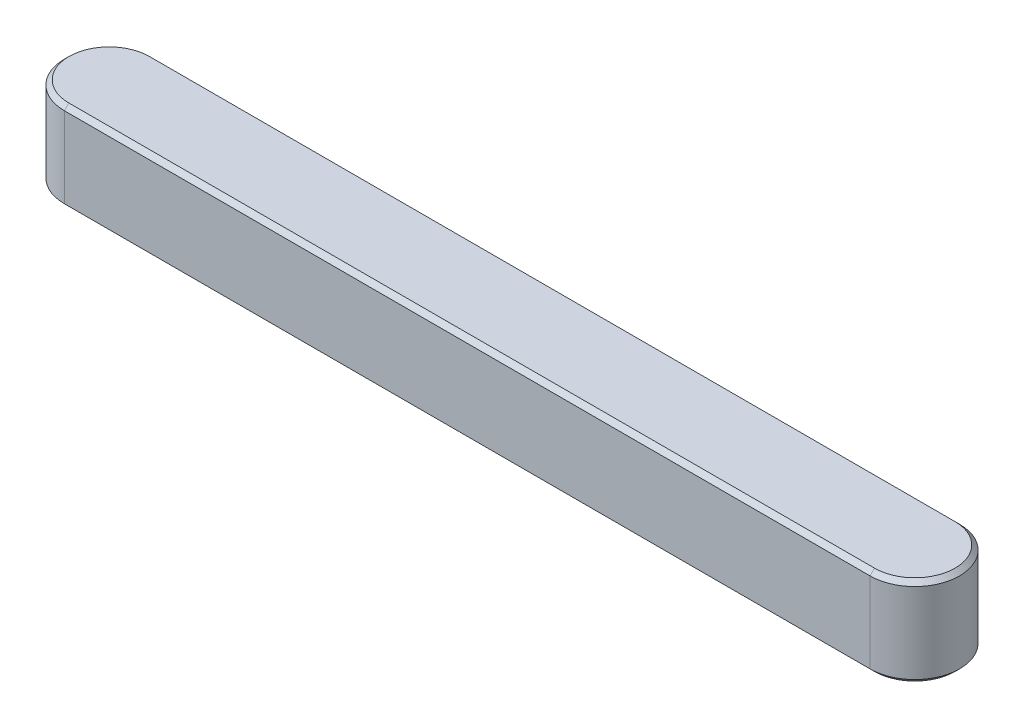
from build123d import *

# Parameters (mm, degrees)
SKETCH1_W           = 60
SKETCH1_H           = 6
BOSS_EXTRUDE1_DEPTH = 6
FILLET1_RADIUS      = 3
FILLET1_LENGTH      = 6
FILLET2_RADIUS      = 3
FILLET2_LENGTH      = 6
CHAMFER2_SIZE       = 0.3


with BuildPart() as part:
    # Sketch1 → Boss-Extrude1 (new body)
    with BuildSketch(Plane(origin=(0, 0, 0), x_dir=(1, 0, 0), z_dir=(0, 1, 0))):
        Rectangle(SKETCH1_W, SKETCH1_H)
    extrude(amount=BOSS_EXTRUDE1_DEPTH)

    # Fillet1: full round fillet: the end face becomes a half cylinder, R = half its width
    fillet1_face = Plane((-30, 3, 0), x_dir=(0, -1, 0), z_dir=(-1, 0, 0))  # on the end face: x along it, z out of the body
    fillet1_slab = fillet1_face.offset(-FILLET1_RADIUS / 2) * Box(FILLET1_LENGTH, 2 * FILLET1_RADIUS, FILLET1_RADIUS, mode=Mode.PRIVATE)  # the body's end, R deep
    fillet1_round = Plane((-27, 3, 0), x_dir=(-1, 0, 0), z_dir=(0, -1, 0)) * Cylinder(FILLET1_RADIUS, FILLET1_LENGTH, mode=Mode.PRIVATE)  # its axis R under the face
    add(fillet1_slab - fillet1_round, mode=Mode.SUBTRACT)

    # Fillet2: full round fillet: the end face becomes a half cylinder, R = half its width
    fillet2_face = Plane((30, 3, 0), x_dir=(0, 1, 0), z_dir=(1, 0, 0))  # on the end face: x along it, z out of the body
    fillet2_slab = fillet2_face.offset(-FILLET2_RADIUS / 2) * Box(FILLET2_LENGTH, 2 * FILLET2_RADIUS, FILLET2_RADIUS, mode=Mode.PRIVATE)  # the body's end, R deep
    fillet2_round = Plane((27, 3, 0), x_dir=(1, 0, 0), z_dir=(0, 1, 0)) * Cylinder(FILLET2_RADIUS, FILLET2_LENGTH, mode=Mode.PRIVATE)  # its axis R under the face
    add(fillet2_slab - fillet2_round, mode=Mode.SUBTRACT)

    # Chamfer2
    chamfer2_edges = [part.edges().sort_by_distance(p)[0] for p in [
        (0, 0, 3),
        (0, 6, 3),
        (-30, 6, 0),
        (-30, 0, 0),
        (0, 0, -3),
        (0, 6, -3),
        (30, 0, 0),
        (30, 6, 0),
    ]]
    chamfer(chamfer2_edges, length=CHAMFER2_SIZE)


solid = part.part
